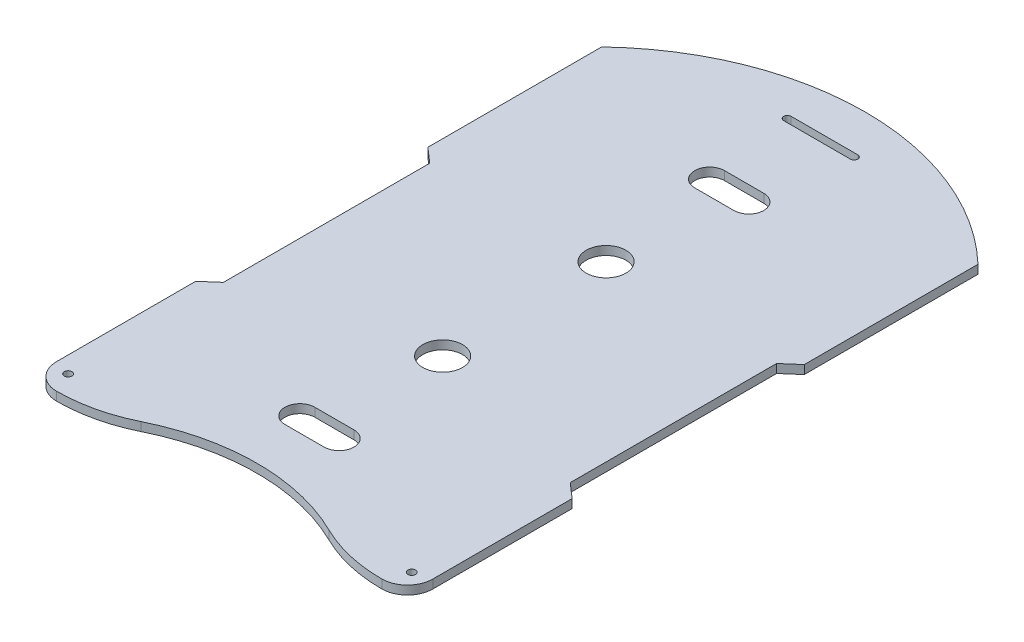
from build123d import *

# Parameters (mm, degrees)
CROQUIS1_R              = 8
CROQUIS1_R_2            = 1.55
SALIENTE_EXTRUIR1_DEPTH = 3.5


with BuildPart() as part:
    # Croquis1 → Saliente-Extruir1 (new body)
    with BuildSketch(Plane(origin=(0, 0, 0), x_dir=(1, 0, 0), z_dir=(0, 1, 0))):
        with BuildLine():
            Line((-75.83, 106.96), (-75.83, 36.96))
            Line((-75.83, 36.96), (-69.88, 31.76))
            Line((-69.88, 31.76), (-69.88, -51.39))
            Line((-69.88, -51.39), (-75.83, -56.59))
            Line((-75.83, -56.59), (-75.83, -112.67))
            ThreePointArc((-75.83, -112.67), (-72.813199846, -119.953199846), (-65.53, -122.97))
            ThreePointArc((-65.53, -122.97), (-51.316231926, -121.339014909), (-37.841336827, -116.530842982))
            ThreePointArc((-37.841336827, -116.530842982), (0, -107.730623626), (37.841336827, -116.530842982))
            ThreePointArc((37.841336827, -116.530842982), (51.316231926, -121.339014909), (65.53, -122.97))
            ThreePointArc((65.53, -122.97), (72.813199846, -119.953199846), (75.83, -112.67))
            Line((75.83, -112.67), (75.83, -56.59))
            Line((75.83, -56.59), (69.88, -51.39))
            Line((69.88, -51.39), (69.88, 31.76))
            Line((69.88, 31.76), (75.83, 36.96))
            Line((75.83, 36.96), (75.83, 106.96))
            ThreePointArc((75.83, 106.96), (0, 137.38), (-75.83, 106.96))
        make_face()
        with Locations(Location((0, 32.92, 0), (0, 0, 270))):
            Circle(CROQUIS1_R, mode=Mode.SUBTRACT)
        with Locations(Location((69.23, -114.59, 0), (0, 0, 270))):
            Circle(CROQUIS1_R_2, mode=Mode.SUBTRACT)
        with Locations(Location((0, -32.92, 0), (0, 0, 90))):
            Circle(CROQUIS1_R, mode=Mode.SUBTRACT)
        with Locations(Location((-69.23, -114.59, 0), (0, 0, 90))):
            Circle(CROQUIS1_R_2, mode=Mode.SUBTRACT)
        with BuildLine():
            Line((-7.895, -88.57), (7.895, -88.57))
            ThreePointArc((7.895, -88.57), (13.91, -82.555), (7.895, -76.54))
            Line((7.895, -76.54), (-7.895, -76.54))
            ThreePointArc((-7.895, -76.54), (-13.91, -82.555), (-7.895, -88.57))
        make_face(mode=Mode.SUBTRACT)
        with BuildLine():
            Line((-7.895, 88.57), (7.895, 88.57))
            ThreePointArc((7.895, 88.57), (13.91, 82.555), (7.895, 76.54))
            Line((7.895, 76.54), (-7.895, 76.54))
            ThreePointArc((-7.895, 76.54), (-13.91, 82.555), (-7.895, 88.57))
        make_face(mode=Mode.SUBTRACT)
        with BuildLine():
            Line((-13.415, 120.93), (13.415, 120.93))
            ThreePointArc((13.415, 120.93), (14.915, 119.43), (13.415, 117.93))
            Line((13.415, 117.93), (-13.415, 117.93))
            ThreePointArc((-13.415, 117.93), (-14.915, 119.43), (-13.415, 120.93))
        make_face(mode=Mode.SUBTRACT)
    extrude(amount=SALIENTE_EXTRUIR1_DEPTH)


solid = part.part
